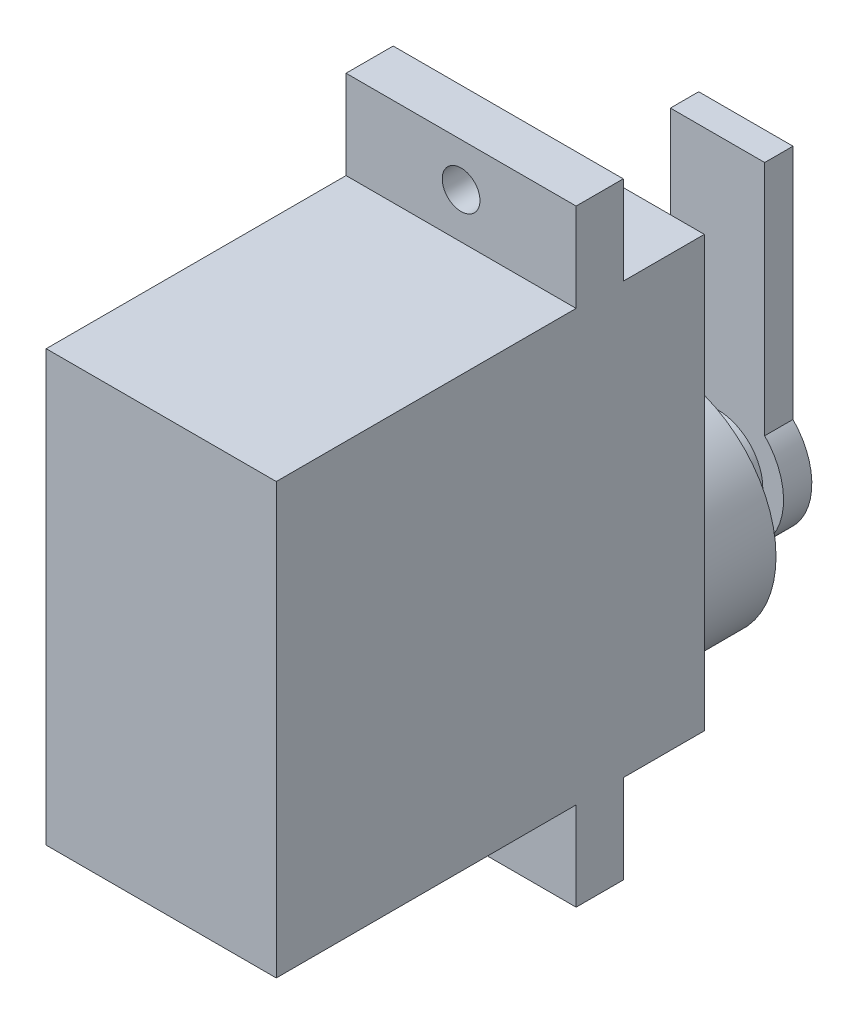
from build123d import *

# Parameters (mm, degrees)
CROQUIS1_W              = 12.2
CROQUIS1_H              = 22.8
SALIENTE_EXTRUIR1_DEPTH = 22.7
CROQUIS2_W              = 12.2
CROQUIS2_H              = 32.2
SALIENTE_EXTRUIR2_DEPTH = 2.5
CROQUIS3_R              = 1
CORTAR_EXTRUIR1_DEPTH   = 4.5
CROQUIS4_R              = 5.9
SALIENTE_EXTRUIR3_DEPTH = 4
CROQUIS5_R              = 2.4
SALIENTE_EXTRUIR4_DEPTH = 2.8
CROQUIS6_R              = 3.5
SALIENTE_EXTRUIR5_DEPTH = 1.5
CROQUIS7_W              = 5
CROQUIS7_H              = 13
SALIENTE_EXTRUIR6_DEPTH = 1.5


with BuildPart() as part:
    # Croquis1 → Saliente-Extruir1 (new body)
    with BuildSketch(Plane.XY.offset(-4.3)):
        with Locations((0, 5.5)):
            Rectangle(CROQUIS1_W, CROQUIS1_H)
    extrude(amount=SALIENTE_EXTRUIR1_DEPTH)

    # Croquis2 → Saliente-Extruir2 (add)
    with BuildSketch(Plane.XY):
        with Locations((0, 5.5)):
            Rectangle(CROQUIS2_W, CROQUIS2_H)
    extrude(amount=SALIENTE_EXTRUIR2_DEPTH)

    # Croquis3 → Cortar-Extruir1 (cut)
    with BuildSketch(Plane.XY.offset(-1)):
        with Locations((0, -8.3)):
            Circle(CROQUIS3_R)
        with Locations((0, 19.3)):
            Circle(CROQUIS3_R)
    extrude(amount=CORTAR_EXTRUIR1_DEPTH, mode=Mode.SUBTRACT)

    # Croquis4 → Saliente-Extruir3 (add)
    with BuildSketch(Plane.XY.offset(-8.3)):
        with Locations(Location((0, 0, 0), (0, 0, 270))):
            Circle(CROQUIS4_R)
    extrude(amount=SALIENTE_EXTRUIR3_DEPTH)

    # Croquis5 → Saliente-Extruir4 (add)
    with BuildSketch(Plane.XY.offset(-11.1)):
        Circle(CROQUIS5_R)
    extrude(amount=SALIENTE_EXTRUIR4_DEPTH)

    # Croquis6 → Saliente-Extruir5 (add)
    with BuildSketch(Plane.XY.offset(-12.6)):
        Circle(CROQUIS6_R)
    extrude(amount=SALIENTE_EXTRUIR5_DEPTH)

    # Croquis7 → Saliente-Extruir6 (add)
    with BuildSketch(Plane.XY.offset(-12.6)):
        with Locations((0, 8.5)):
            Rectangle(CROQUIS7_W, CROQUIS7_H)
    extrude(amount=SALIENTE_EXTRUIR6_DEPTH)


solid = part.part
